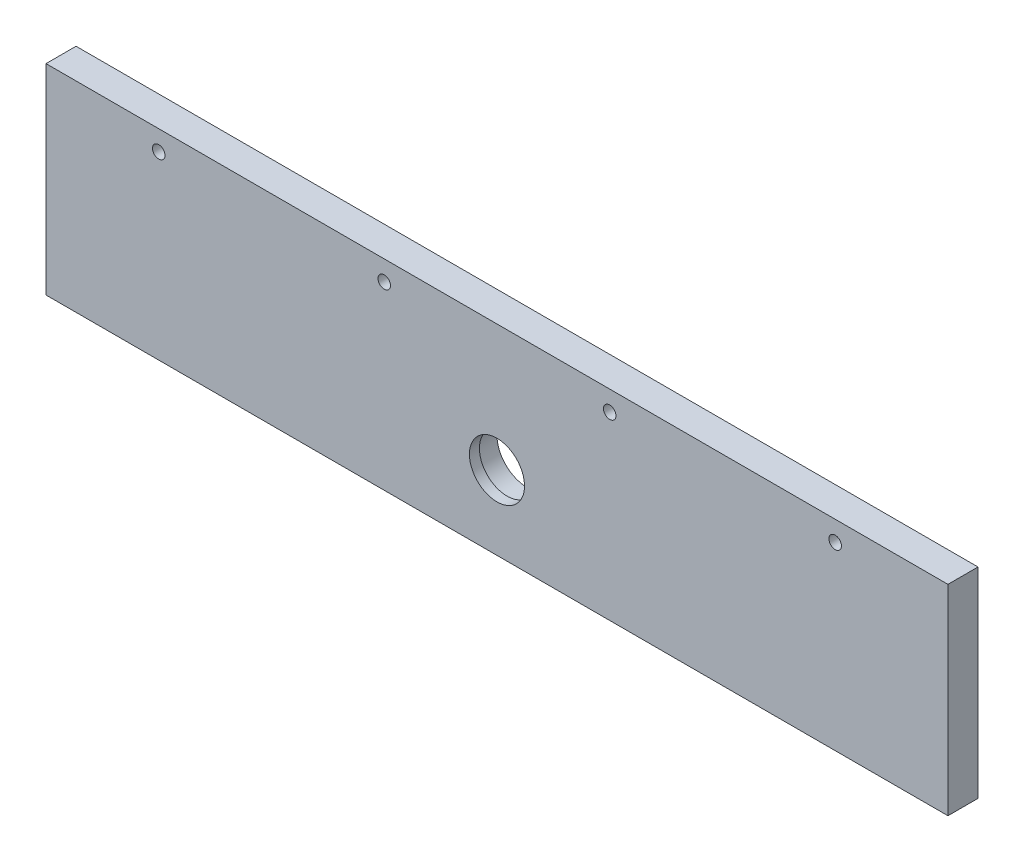
from build123d import *

# Parameters (mm, degrees)
SKETCH1_W           = 360
SKETCH1_H           = 80
BOSS_EXTRUDE1_DEPTH = 12
CUT_EXTRUDE1_REACH  = 186.781
SKETCH2_R           = 2.5
CUT_EXTRUDE2_DEPTH  = 8
CUT_EXTRUDE3_DEPTH  = 6.5
LPATTERN1_COUNT     = 4
LPATTERN1_PITCH     = 90
SKETCH7_R           = 12
CUT_EXTRUDE4_DEPTH  = 8
CUT_EXTRUDE5_REACH  = 186.564
SKETCH8_R           = 11


with BuildPart() as part:
    # Sketch1 → Boss-Extrude1 (new body)
    with BuildSketch(Plane.XY):
        Rectangle(SKETCH1_W, SKETCH1_H)
    extrude(amount=BOSS_EXTRUDE1_DEPTH)

    # Sketch2 → Cut-Extrude1 (cut, up to next)
    with BuildSketch(Plane.XY.offset(12), mode=Mode.PRIVATE) as cut_extrude1_sk1:
        with Locations((-135, 32)):
            Circle(SKETCH2_R)
    cut_extrude1_tool1 = extrude(cut_extrude1_sk1.sketch, amount=-CUT_EXTRUDE1_REACH, mode=Mode.PRIVATE) & part.part
    cut_extrude1 = cut_extrude1_tool1.solids().sort_by_distance((-135, 32, 12))[0]
    add(cut_extrude1, mode=Mode.SUBTRACT)

    # Sketch4 → Cut-Extrude2 (cut)
    with BuildSketch(Plane(origin=(-23.391380574, 111.176150639, 0), x_dir=(-1, 0, 0), z_dir=(0, 0, -1))):
        with BuildLine():
            Line((107.608619426, -137.176150639), (115.608619426, -137.176150639))
            ThreePointArc((115.608619426, -137.176150639), (117.608619426, -139.176150639), (115.608619426, -141.176150639))
            Line((115.608619426, -141.176150639), (107.608619426, -141.176150639))
            ThreePointArc((107.608619426, -141.176150639), (105.608619426, -139.176150639), (107.608619426, -137.176150639))
        make_face()
    cut_extrude2 = extrude(amount=-CUT_EXTRUDE2_DEPTH, mode=Mode.SUBTRACT)

    # Sketch6 → Cut-Extrude3 (cut)
    with BuildSketch(Plane(origin=(-23.391380574, 111.176150639, 0), x_dir=(-1, 0, 0), z_dir=(0, 0, -1))):
        with BuildLine():
            Line((114.108619426, -134.176150639), (114.108619426, -164.82997736))
            ThreePointArc((114.108619426, -164.82997736), (111.608619426, -167.32997736), (109.108619426, -164.82997736))
            Line((109.108619426, -164.82997736), (109.108619426, -134.176150639))
            ThreePointArc((109.108619426, -134.176150639), (111.608619426, -131.676150639), (114.108619426, -134.176150639))
        make_face()
    cut_extrude3 = extrude(amount=-CUT_EXTRUDE3_DEPTH, mode=Mode.SUBTRACT)

    # LPattern1: Cut-Extrude1, Cut-Extrude2, Cut-Extrude3 ×4
    with Locations(*[(i * LPATTERN1_PITCH, 0, 0) for i in range(1, LPATTERN1_COUNT)]):
        add(cut_extrude1, mode=Mode.SUBTRACT)
        add(cut_extrude2, mode=Mode.SUBTRACT)
        add(cut_extrude3, mode=Mode.SUBTRACT)

    # Sketch7 → Cut-Extrude4 (cut)
    with BuildSketch(Plane(origin=(0, 0, 0), x_dir=(-1, 0, 0), z_dir=(0, 0, -1))):
        with Locations((0, -10.5)):
            Circle(SKETCH7_R)
    extrude(amount=-CUT_EXTRUDE4_DEPTH, mode=Mode.SUBTRACT)

    # Sketch8 → Cut-Extrude5 (cut, up to next)
    with BuildSketch(Plane(origin=(0, 0, 8), x_dir=(-1, 0, 0), z_dir=(0, 0, -1)), mode=Mode.PRIVATE) as cut_extrude5_sk1:
        with Locations((0, -10.5)):
            Circle(SKETCH8_R)
    cut_extrude5_tool1 = extrude(cut_extrude5_sk1.sketch, amount=-CUT_EXTRUDE5_REACH, mode=Mode.PRIVATE) & part.part
    add(cut_extrude5_tool1.solids().sort_by_distance((0, -10.5, 8))[0], mode=Mode.SUBTRACT)


solid = part.part
